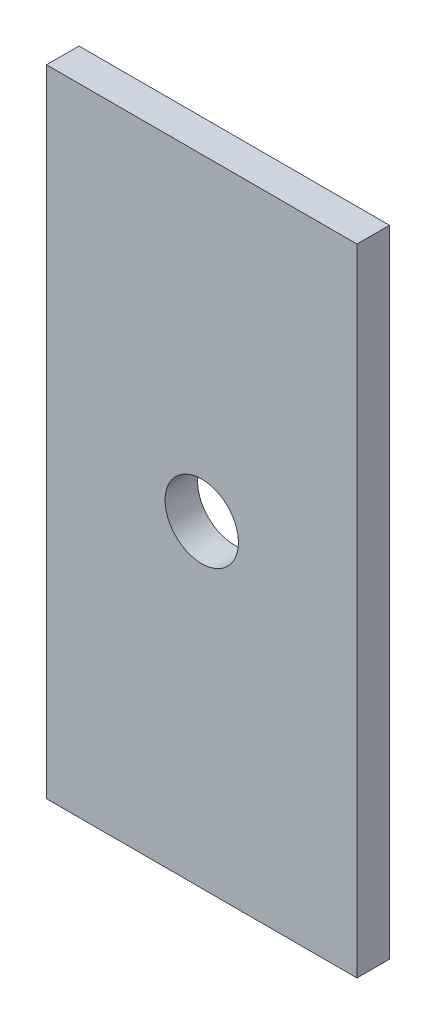
from build123d import *

# Parameters (mm, degrees)
SKETCH1_W           = 25.4
SKETCH1_H           = 52
BOSS_EXTRUDE1_DEPTH = 2.66
SKETCH2_R           = 3
CUT_EXTRUDE1_DEPTH  = 30


with BuildPart() as part:
    # Sketch1 → Boss-Extrude1 (new body)
    with BuildSketch(Plane.XY):
        with Locations((12.7, 26)):
            Rectangle(SKETCH1_W, SKETCH1_H)
    extrude(amount=BOSS_EXTRUDE1_DEPTH)

    # Sketch2 → Cut-Extrude1 (cut)
    with BuildSketch(Plane(origin=(0, 0, 0), x_dir=(-1, 0, 0), z_dir=(0, 0, -1))):
        with Locations((-12.7, 26)):
            Circle(SKETCH2_R)
    extrude(amount=-CUT_EXTRUDE1_DEPTH, mode=Mode.SUBTRACT)


solid = part.part
